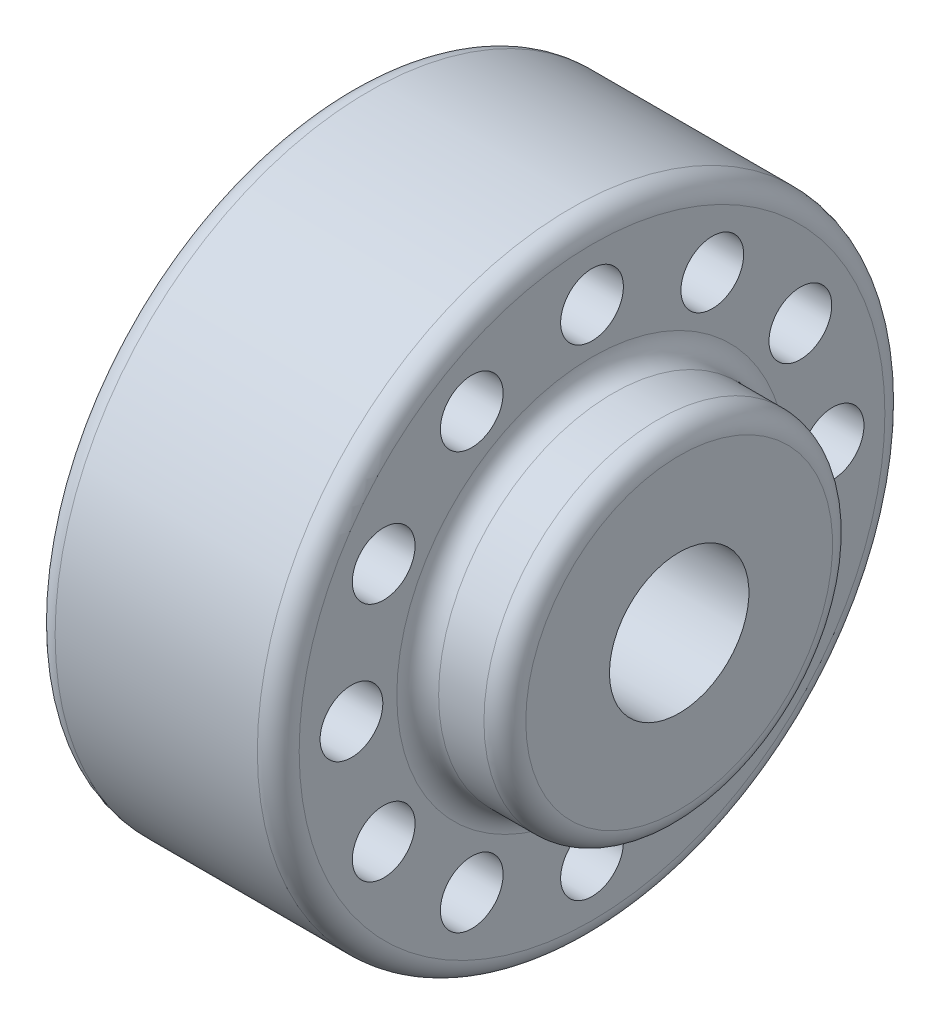
from build123d import *

# Parameters (mm, degrees)
SKETCH2_R          = 4.5
CUT_EXTRUDE1_DEPTH = 80.411900988
CIRPATTERN1_COUNT  = 12


with BuildPart() as part:
    # Sketch1 → Revolve1 (revolve)
    with BuildSketch(Plane.XY, mode=Mode.PRIVATE) as revolve1_sk:
        with BuildLine():
            Line((14.5, 45), (-14.5, 45))
            ThreePointArc((-14.5, 45), (-16.621320344, 44.121320344), (-17.5, 42))
            Line((-17.5, 42), (-17.5, 28))
            ThreePointArc((-17.5, 28), (-18.378679656, 25.878679656), (-20.5, 25))
            Line((-20.5, 25), (-27, 25))
            ThreePointArc((-27, 25), (-29.121320344, 24.121320344), (-30, 22))
            Line((-30, 22), (-30, 10))
            Line((-30, 10), (30, 10))
            Line((30, 10), (30, 22))
            ThreePointArc((30, 22), (29.121320344, 24.121320344), (27, 25))
            Line((27, 25), (20.5, 25))
            ThreePointArc((20.5, 25), (18.378679656, 25.878679656), (17.5, 28))
            Line((17.5, 28), (17.5, 42))
            ThreePointArc((17.5, 42), (16.621320344, 44.121320344), (14.5, 45))
        make_face()
    revolve(revolve1_sk.sketch.rotate(Axis((45.718562874, 0, 0), (1, 0, 0)), 90), axis=Axis((45.718562874, 0, 0), (1, 0, 0)))

    # Sketch2 → Cut-Extrude1 (cut, through all)
    with BuildSketch(Plane(origin=(17.5, 0, 0), x_dir=(0, 0, -1), z_dir=(1, 0, 0))):
        with Locations((0, 34.5)):
            Circle(SKETCH2_R)
    cut_extrude1 = extrude(amount=-CUT_EXTRUDE1_DEPTH, mode=Mode.SUBTRACT)

    # CirPattern1: Cut-Extrude1 ×12 about axis
    cirpattern1_axis = Axis((0, 0, 0), (1, 0, 0))
    for i in range(1, CIRPATTERN1_COUNT):
        add(cut_extrude1.rotate(cirpattern1_axis, i * 360 / CIRPATTERN1_COUNT), mode=Mode.SUBTRACT)


solid = part.part
